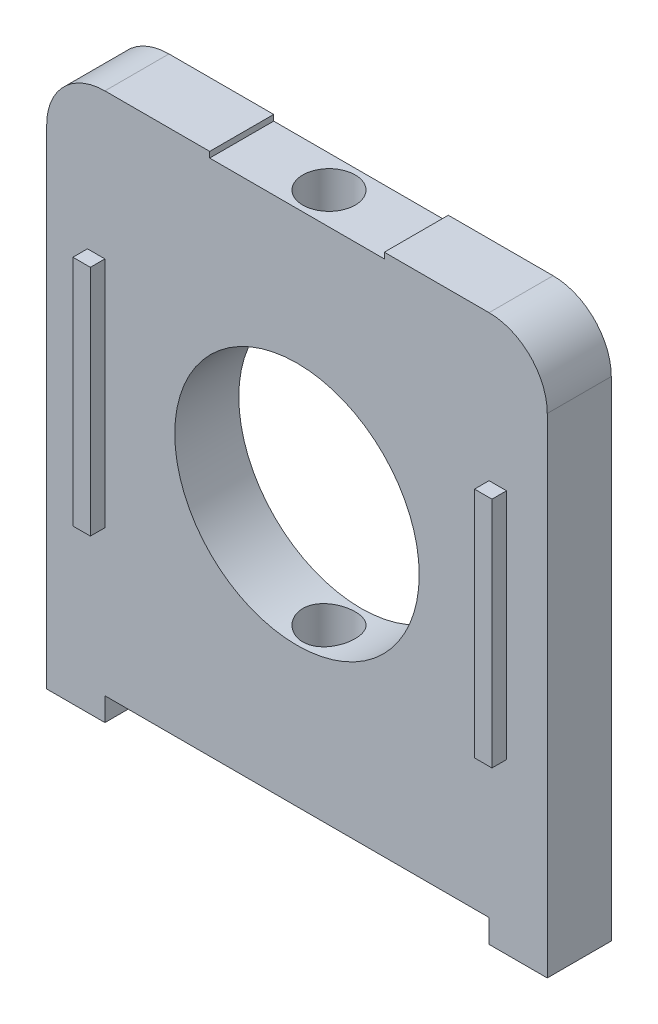
from build123d import *

# Parameters (mm, degrees)
SKETCH1_W            = 43
SKETCH1_H            = 45
SKETCH1_R            = 10.5
BOSS_EXTRUDE1_DEPTH  = 2.75
FILLET1_R            = 5
SKETCH2_W            = 15
SKETCH2_H            = 0.5
CUT_EXTRUDE1_DEPTH   = 10
M4_CLEARANCE_HOLE1_D = 4.5
SKETCH5_W            = 1.5
SKETCH5_H            = 20
BOSS_EXTRUDE2_DEPTH  = 4
SKETCH6_W            = 5
SKETCH6_H            = 2
BOSS_EXTRUDE3_DEPTH  = 2.75


with BuildPart() as part:
    # Sketch1 → Boss-Extrude1 (new, symmetric)
    with BuildSketch(Plane.XY):
        Rectangle(SKETCH1_W, SKETCH1_H)
        Circle(SKETCH1_R, mode=Mode.SUBTRACT)
    extrude(amount=BOSS_EXTRUDE1_DEPTH, both=True)

    # Fillet1
    fillet1_edges = [part.edges().sort_by_distance(p)[0] for p in [
        (-21.5, 22.5, 0),
        (21.5, 22.5, 0),
    ]]
    fillet(fillet1_edges, radius=FILLET1_R)

    # Sketch2 → Cut-Extrude1 (cut)
    with BuildSketch(Plane.XY.offset(2.75)):
        with Locations((0, 22.25)):
            Rectangle(SKETCH2_W, SKETCH2_H)
    extrude(amount=-CUT_EXTRUDE1_DEPTH, mode=Mode.SUBTRACT)

    # M4 Clearance Hole1 (through all)
    with Locations(Plane(origin=(0, 22, 0), x_dir=(1, 0, 0), z_dir=(0, 1, 0))):
        with Locations((0, 0)):
            Hole(M4_CLEARANCE_HOLE1_D / 2)

    # Sketch5 → Boss-Extrude2 (add, symmetric)
    with BuildSketch(Plane.XY):
        with Locations((-17.25, 0)):
            Rectangle(SKETCH5_W, SKETCH5_H)
        with Locations((17.25, 0)):
            Rectangle(SKETCH5_W, SKETCH5_H)
    extrude(amount=BOSS_EXTRUDE2_DEPTH, both=True)

    # Sketch6 → Boss-Extrude3 (add, symmetric)
    with BuildSketch(Plane.XY):
        with Locations((-19, -23.5)):
            Rectangle(SKETCH6_W, SKETCH6_H)
        with Locations((19, -23.5)):
            Rectangle(SKETCH6_W, SKETCH6_H)
    extrude(amount=BOSS_EXTRUDE3_DEPTH, both=True)


solid = part.part
